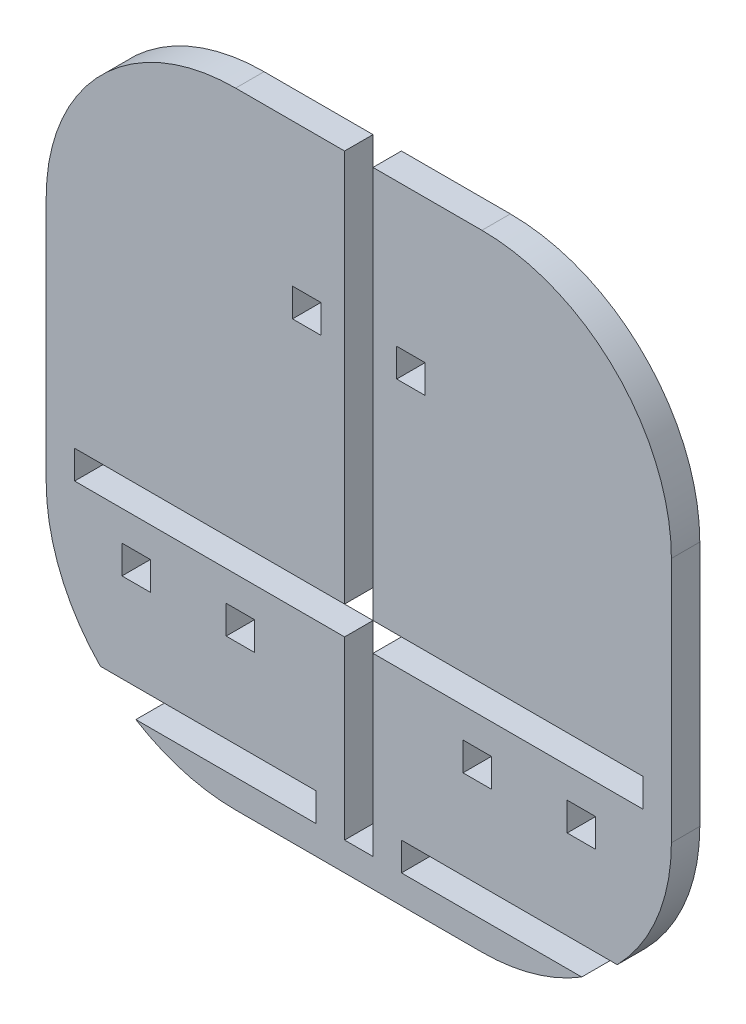
from build123d import *

# Parameters (mm, degrees)
CROQUIS1_W              = 3
CROQUIS1_H              = 3
SALIENTE_EXTRUIR1_DEPTH = 3


with BuildPart() as part:
    # Croquis1 → Saliente-Extruir1 (new body)
    with BuildSketch(Plane.XY):
        with BuildLine():
            Line((-30, -11.425), (-30, -8.425))
            Line((-30, -8.425), (-1.5, -8.425))
            Line((-1.5, -8.425), (-1.5, 30))
            Line((-1.5, 30), (-1.5, 33))
            Line((-1.5, 33), (-13, 33))
            ThreePointArc((-13, 33), (-27.142135624, 27.142135624), (-33, 13))
            Line((-33, 13), (-33, -13))
            ThreePointArc((-33, -13), (-31.515630385, -20.561179235), (-27.282856857, -27))
            Line((-27.282856857, -27), (-4.502856857, -27))
            Line((-4.502856857, -27), (-4.502856857, -30))
            Line((-4.502856857, -30), (-23.535653753, -30))
            ThreePointArc((-23.535653753, -30), (-18.477225575, -32.235384062), (-13, -33))
            Line((-13, -33), (13, -33))
            ThreePointArc((13, -33), (18.477225575, -32.235384062), (23.535653753, -30))
            Line((23.535653753, -30), (4.502856857, -30))
            Line((4.502856857, -30), (4.502856857, -27))
            Line((4.502856857, -27), (27.282856857, -27))
            ThreePointArc((27.282856857, -27), (31.515630385, -20.561179235), (33, -13))
            Line((33, -13), (33, 13))
            ThreePointArc((33, 13), (27.142135624, 27.142135624), (13, 33))
            Line((13, 33), (1.5, 33))
            Line((1.5, 33), (1.5, 30))
            Line((1.5, 30), (1.5, -8.425))
            Line((1.5, -8.425), (30, -8.425))
            Line((30, -8.425), (30, -11.425))
            Line((30, -11.425), (1.5, -11.425))
            Line((1.5, -11.425), (1.5, -30))
            Line((1.5, -30), (-1.5, -30))
            Line((-1.5, -30), (-1.5, -11.425))
            Line((-1.5, -11.425), (-30, -11.425))
        make_face()
        with Locations((-23.5, -16.1)):
            Rectangle(CROQUIS1_W, CROQUIS1_H, mode=Mode.SUBTRACT)
        with Locations((-12.5, -16.1)):
            Rectangle(CROQUIS1_W, CROQUIS1_H, mode=Mode.SUBTRACT)
        with Locations((12.5, -16.1)):
            Rectangle(CROQUIS1_W, CROQUIS1_H, mode=Mode.SUBTRACT)
        with Locations((23.5, -16.1)):
            Rectangle(CROQUIS1_W, CROQUIS1_H, mode=Mode.SUBTRACT)
        with Locations((-5.5, 16.4)):
            Rectangle(CROQUIS1_W, CROQUIS1_H, mode=Mode.SUBTRACT)
        with Locations((5.5, 16.4)):
            Rectangle(CROQUIS1_W, CROQUIS1_H, mode=Mode.SUBTRACT)
    extrude(amount=SALIENTE_EXTRUIR1_DEPTH)


solid = part.part
